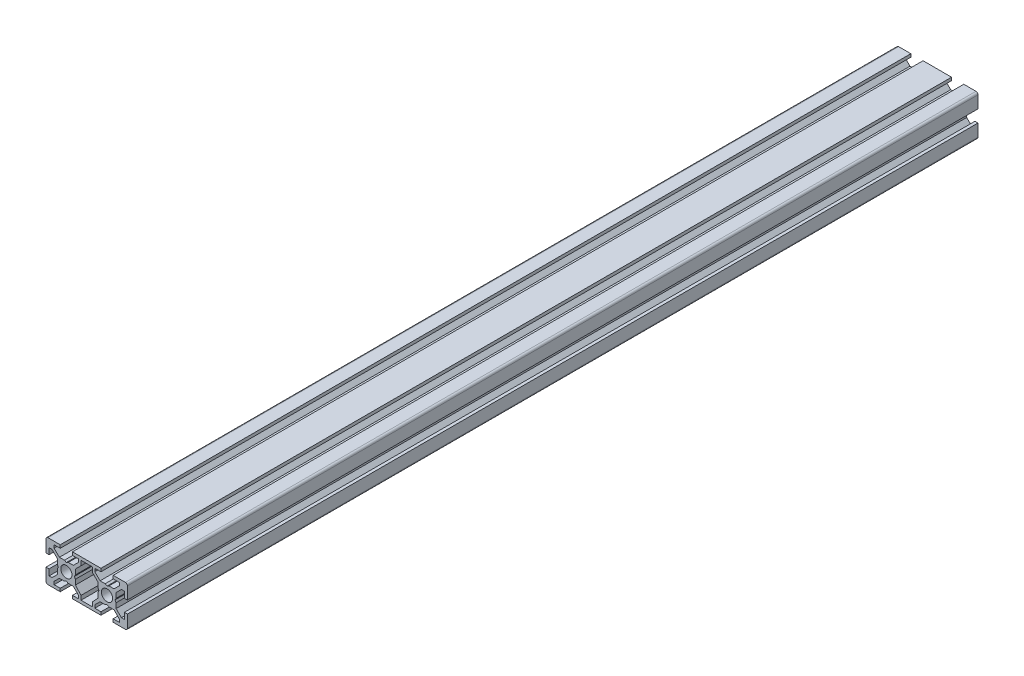
from build123d import *

# Parameters (mm, degrees)
SKETCH1_R           = 2.75
BOSS_EXTRUDE1_DEPTH = 418
FILLET2_R           = 1
FILLET4_R           = 1
FILLET5_R           = 1
FILLET6_R           = 1


with BuildPart() as part:
    # Sketch1 → Boss-Extrude1 (new body)
    with BuildSketch(Plane.XY):
        Polygon((-3.001792446, 10), (-10, 10), (-10, 3.001792446), (-8.500771543, 3.001792446), (-8.500771543, 6.014407427), (-7.045753692, 6.014407427), (-4.458187435, 3.426841169), (-4.458187435, 0.939646666), (-3.934715846, 0), (-4.45749106, -0.939646666), (-4.458187435, -3.426841169), (-7.045753692, -6.014407427), (-8.500771543, -6.014407427), (-8.500771543, -3.001792446), (-10, -3.001792446), (-10, -10), (-3.001792446, -10), (-3.001792446, -8.499999951), (-6.014791508, -8.499999951), (-6.014791508, -7.045753643), (-3.427225251, -4.458187385), (-0.939604714, -4.458187385), (-0.00108721, -3.933944043), (0.937618184, -4.457850876), (3.425238721, -4.457850876), (6.012804978, -7.045417133), (6.012804978, -8.500000007), (3.001792545, -8.500000007), (3.001792545, -10), (16.998207455, -10), (16.998207455, -8.500000007), (13.987195022, -8.500000007), (13.987195022, -7.045417133), (16.574761279, -4.457850876), (19.062381816, -4.457850876), (20.00108721, -3.933944043), (20.939604714, -4.458187385), (23.427225251, -4.458187385), (26.014791508, -7.045753643), (26.014791508, -8.499999951), (23.001792446, -8.499999951), (23.001792446, -10), (30, -10), (30, -3.001792446), (28.500771543, -3.001792446), (28.500771543, -6.014407427), (27.045753692, -6.014407427), (24.458187435, -3.426841169), (24.45749106, -0.939646666), (23.934715846, 0), (24.458187435, 0.939646666), (24.458187435, 3.426841169), (27.045753692, 6.014407427), (28.500771543, 6.014407427), (28.500771543, 3.001792446), (30, 3.001792446), (30, 10), (23.001792446, 10), (23.001792446, 8.499999951), (26.014791508, 8.499999951), (26.014791508, 7.045753643), (23.427225251, 4.458187385), (20.939604714, 4.458187385), (20.00108721, 3.933944043), (19.062381816, 4.457850876), (16.574761279, 4.457850876), (13.987195022, 7.045417133), (13.987195022, 8.499999951), (16.998207356, 8.499999951), (16.998207356, 10), (3.001792643, 10), (3.001792643, 8.499999951), (6.012804978, 8.499999951), (6.012804978, 7.045417133), (3.425238721, 4.457850876), (0.937618184, 4.457850876), (-0.00108721, 3.933944043), (-0.939604714, 4.458187385), (-3.427225251, 4.458187385), (-6.014791508, 7.045753643), (-6.014791508, 8.499999951), (-3.001792446, 8.499999951), align=None)
        Circle(SKETCH1_R, mode=Mode.SUBTRACT)
        with Locations(Location((20, 0, 0), (0, 0, 180))):
            Circle(SKETCH1_R, mode=Mode.SUBTRACT)
        Polygon((7.208733292, -6.419793455), (7.208733292, -8.500000007), (12.791266708, -8.500000007), (12.791266708, -6.419793455), (15.541654987, -3.426231961), (15.541209058, -0.938611464), (16.065284154, 0), (15.54250894, 0.939646666), (15.541655044, 3.426231961), (12.791266708, 6.17760654), (12.791266708, 8.499999951), (7.208733292, 8.499999951), (7.208733292, 6.17760654), (4.458344956, 3.426231961), (4.45749106, 0.939646666), (3.934715846, 0), (4.458790942, -0.938611464), (4.458345013, -3.426231961), align=None, mode=Mode.SUBTRACT)
    extrude(amount=BOSS_EXTRUDE1_DEPTH)

    # Fillet2
    fillet2_edges = [part.edges().sort_by_distance(p)[0] for p in [
        (-10, -10, 209),
    ]]
    fillet(fillet2_edges, radius=FILLET2_R)

    # Fillet4
    fillet4_edges = [part.edges().sort_by_distance(p)[0] for p in [
        (-10, 10, 209),
    ]]
    fillet(fillet4_edges, radius=FILLET4_R)

    # Fillet5
    fillet5_edges = [part.edges().sort_by_distance(p)[0] for p in [
        (30, 10, 209),
    ]]
    fillet(fillet5_edges, radius=FILLET5_R)

    # Fillet6
    fillet6_edges = [part.edges().sort_by_distance(p)[0] for p in [
        (30, -10, 209),
    ]]
    fillet(fillet6_edges, radius=FILLET6_R)


solid = part.part
